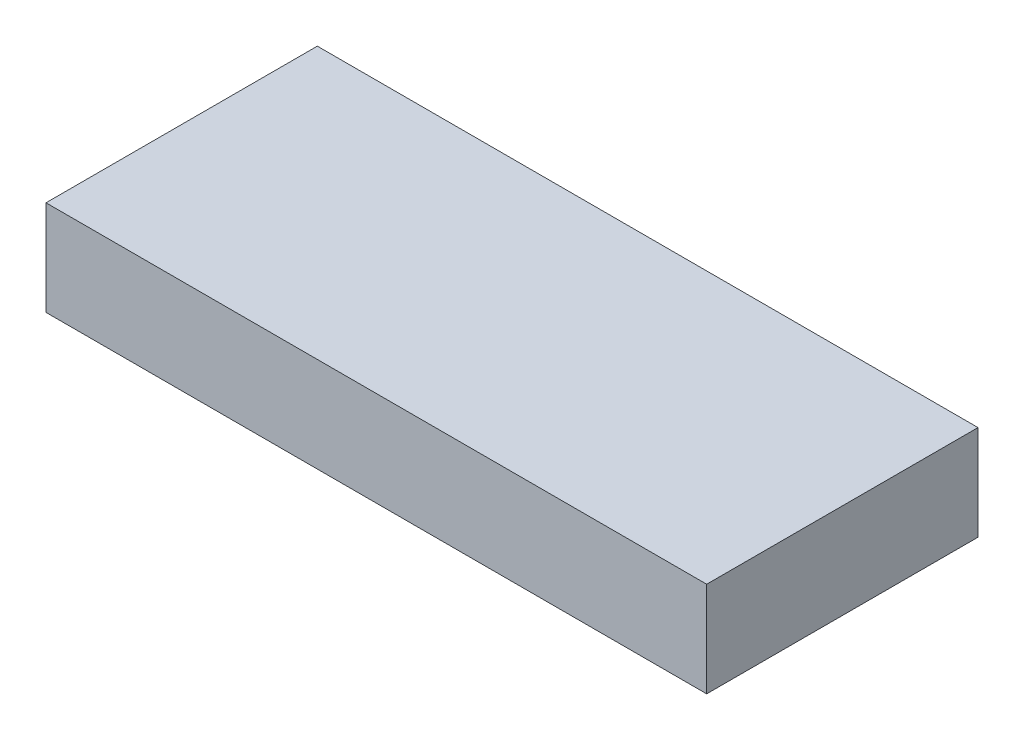
from build123d import *

# Parameters (mm, degrees)
SKETCH1_W           = 37.1094
SKETCH1_H           = 15.24
BOSS_EXTRUDE1_DEPTH = 5.334


with BuildPart() as part:
    # Sketch1 → Boss-Extrude1 (new body)
    with BuildSketch(Plane(origin=(0, 0, 0), x_dir=(1, 0, 0), z_dir=(0, 1, 0))):
        with Locations((18.5547, 7.62)):
            Rectangle(SKETCH1_W, SKETCH1_H)
    extrude(amount=BOSS_EXTRUDE1_DEPTH)


solid = part.part
